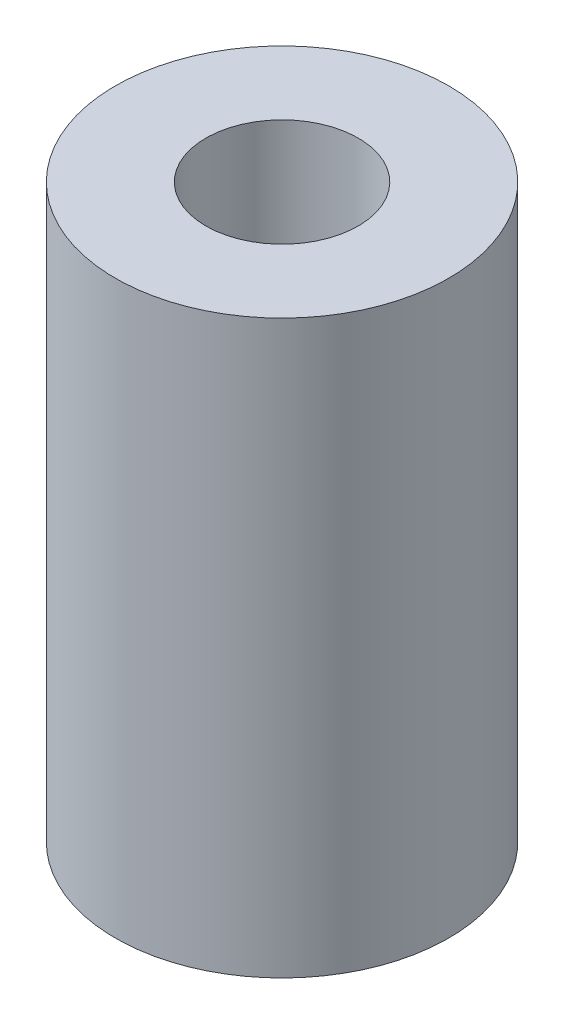
from build123d import *

# Parameters (mm, degrees)
SKETCH1_W             = 1.75
SKETCH1_H             = 6
M2X0_4_TAPPED_HOLE1_D = 1.6


with BuildPart() as part:
    # Sketch1 → Revolve1 (revolve)
    with BuildSketch(Plane.XY, mode=Mode.PRIVATE) as revolve1_sk:
        with Locations((-0.875, 3)):
            Rectangle(SKETCH1_W, SKETCH1_H)
    revolve(revolve1_sk.sketch.rotate(Axis((0, 0, 0), (0, 1, 0)), 270), axis=Axis((0, 0, 0), (0, 1, 0)))

    # M2x0.4 Tapped Hole1 (through all)
    with Locations(Plane(origin=(0, 6, 0), x_dir=(-1, 0, 0), z_dir=(0, 1, 0))):
        with Locations((0, 0)):
            Hole(M2X0_4_TAPPED_HOLE1_D / 2)


solid = part.part
